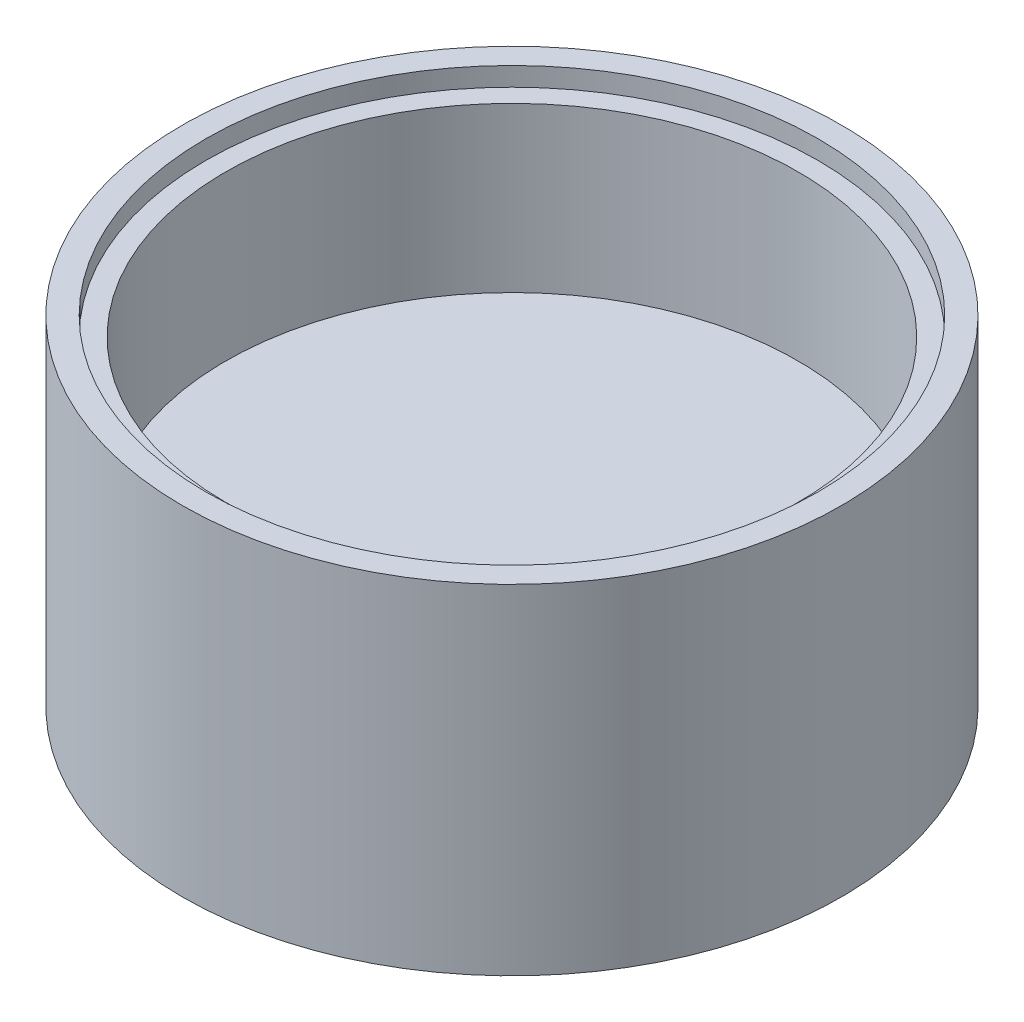
from build123d import *

# Parameters (mm, degrees)
SKETCH1_R           = 17.5
BOSS_EXTRUDE1_DEPTH = 18
SHELL1_T            = -2.3
SKETCH2_R           = 16.25
CUT_EXTRUDE1_DEPTH  = 1
SKETCH4_R           = 15.2
BOSS_EXTRUDE2_DEPTH = 6


with BuildPart() as part:
    # Sketch1 → Boss-Extrude1 (new body)
    with BuildSketch(Plane(origin=(0, 0, 0), x_dir=(1, 0, 0), z_dir=(0, 1, 0))):
        with Locations(Location((0, 0, 0), (0, 0, 270))):
            Circle(SKETCH1_R)
    extrude(amount=BOSS_EXTRUDE1_DEPTH)

    # Shell1
    shell1_openings = [part.faces().sort_by_distance(p)[0] for p in [
        (0, 18, 0),
    ]]
    offset(amount=SHELL1_T, openings=shell1_openings, kind=Kind.INTERSECTION)

    # Sketch2 → Cut-Extrude1 (cut)
    with BuildSketch(Plane(origin=(0, 18, 0), x_dir=(1, 0, 0), z_dir=(0, 1, 0))):
        with Locations(Location((0, 0, 0), (0, 0, 270))):
            Circle(SKETCH2_R)
    extrude(amount=-CUT_EXTRUDE1_DEPTH, mode=Mode.SUBTRACT)

    # Sketch4 → Boss-Extrude2 (add)
    with BuildSketch(Plane(origin=(0, 2.3, 0), x_dir=(1, 0, 0), z_dir=(0, 1, 0))):
        with Locations(Location((0, 0, 0), (0, 0, 270))):
            Circle(SKETCH4_R)
    extrude(amount=BOSS_EXTRUDE2_DEPTH)


solid = part.part
